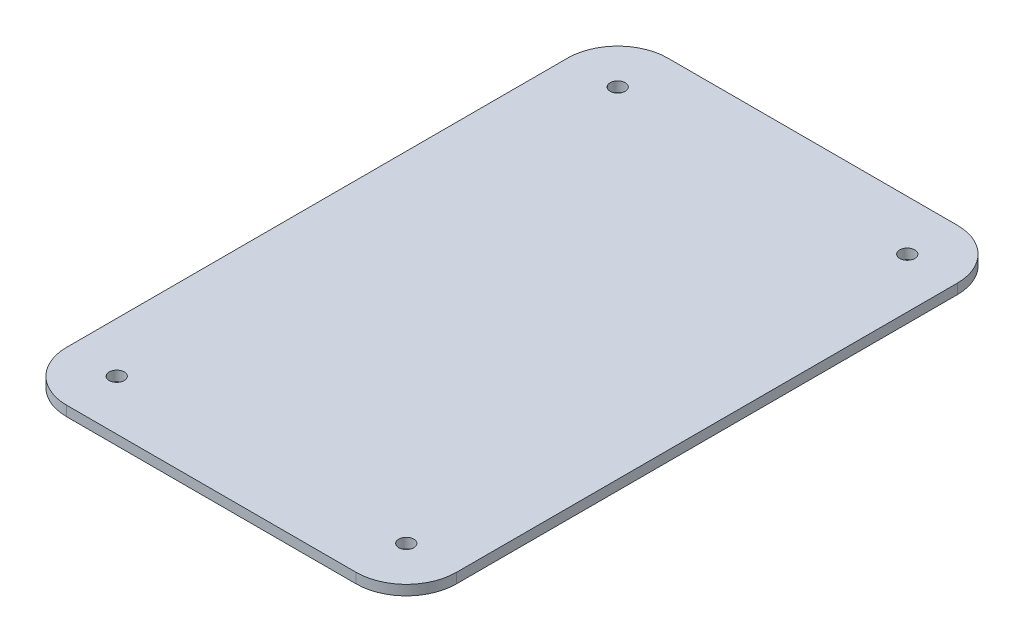
from build123d import *

# Parameters (mm, degrees)
SKETCH1_W           = 77.8
SKETCH1_H           = 120
BOSS_EXTRUDE1_DEPTH = 2
FILLET1_R           = 10
SKETCH2_R           = 1.5
CUT_EXTRUDE1_DEPTH  = 21


with BuildPart() as part:
    # Sketch1 → Boss-Extrude1 (new body)
    with BuildSketch(Plane(origin=(0, 0, 0), x_dir=(1, 0, 0), z_dir=(0, 1, 0))):
        with Locations((-4.469169002, 27.069255629)):
            Rectangle(SKETCH1_W, SKETCH1_H)
    extrude(amount=BOSS_EXTRUDE1_DEPTH)

    # Fillet1
    fillet1_edges = [part.edges().sort_by_distance(p)[0] for p in [
        (-43.369169002, 1, -87.069255629),
        (34.430830998, 1, -87.069255629),
        (34.430830998, 1, 32.930744371),
        (-43.369169002, 1, 32.930744371),
    ]]
    fillet(fillet1_edges, radius=FILLET1_R)

    # Sketch2 → Cut-Extrude1 (cut)
    with BuildSketch(Plane(origin=(0, 2, 0), x_dir=(1, 0, 0), z_dir=(0, 1, 0))):
        with Locations(Location((-33.369169002, -22.930744371, 0), (0, 0, 270))):
            Circle(SKETCH2_R)
        with Locations(Location((24.430830998, -22.930744371, 0), (0, 0, 270))):
            Circle(SKETCH2_R)
        with Locations(Location((-33.369169002, 77.069255629, 0), (0, 0, 270))):
            Circle(SKETCH2_R)
        with Locations(Location((24.430830998, 77.069255629, 0), (0, 0, 270))):
            Circle(SKETCH2_R)
    extrude(amount=-CUT_EXTRUDE1_DEPTH, mode=Mode.SUBTRACT)


solid = part.part
